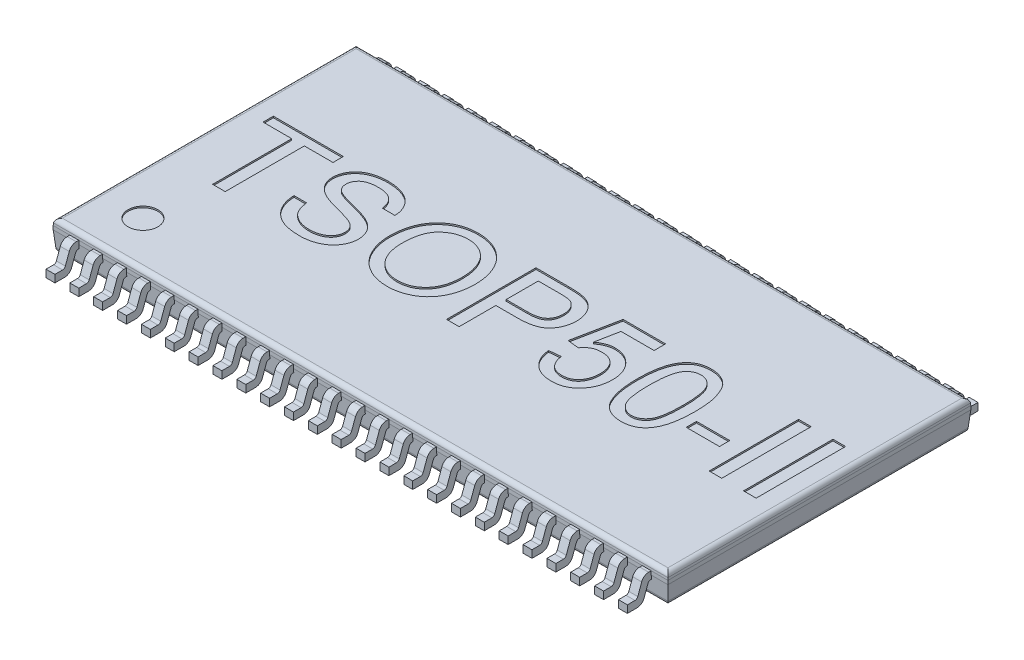
from build123d import *

# Parameters (mm, degrees)
BOSS_EXTRUDE1_START   = 0.715
SKETCH1_W             = 20.62
SKETCH1_H             = 10.16
BOSS_EXTRUDE1_DEPTH   = 0.665
BOSS_EXTRUDE1_DRAFT   = -5
SKETCH2_W             = 20.62
SKETCH2_H             = 10.16
BOSS_EXTRUDE2_DEPTH   = 0.125
SKETCH3_W             = 20.62
SKETCH3_H             = 10.16
BOSS_EXTRUDE3_DEPTH   = 0.21
BOSS_EXTRUDE3_TAPER   = 5
FILLET1_R             = 0.15
BOSS_EXTRUDE4_DEPTH   = 0.15
BOSS_EXTRUDE4_2_DEPTH = 0.15
LPATTERN1_COUNT       = 25
LPATTERN1_PITCH       = 0.8
SKETCH7_R             = 0.5
SKETCH7_W             = 1.115384616
SKETCH7_H             = 0.346153846
SKETCH7_W_2           = 0.423076923
SKETCH7_H_2           = 3
CUT_EXTRUDE1_DEPTH    = 0.05


with BuildPart() as part:
    # Sketch1 → Boss-Extrude1 (with draft: the straight prism first)
    with BuildSketch(Plane(origin=(0, 0, 0), x_dir=(1, 0, 0), z_dir=(0, 1, 0)).offset(BOSS_EXTRUDE1_START)):
        Rectangle(SKETCH1_W, SKETCH1_H)
    extrude(amount=-BOSS_EXTRUDE1_DEPTH)
    # Boss-Extrude1: the draft: its side faces are tilted about the plane it starts from
    boss_extrude1_sides = [part.faces().sort_by_distance(p)[0] for p in [
        (0, 0.3825, 5.08),
        (10.31, 0.3825, 0),
        (0, 0.3825, -5.08),
        (-10.31, 0.3825, 0),
    ]]
    draft(boss_extrude1_sides, Plane(origin=(0, 0, 0), x_dir=(1, 0, 0), z_dir=(0, 1, 0)).offset(BOSS_EXTRUDE1_START), BOSS_EXTRUDE1_DRAFT)

    # Sketch2 → Boss-Extrude2 (add)
    with BuildSketch(Plane(origin=(0, 0.715, 0), x_dir=(1, 0, 0), z_dir=(0, 1, 0))):
        Rectangle(SKETCH2_W, SKETCH2_H)
    extrude(amount=BOSS_EXTRUDE2_DEPTH)

    # Sketch3 → Boss-Extrude3 (add)
    with BuildSketch(Plane(origin=(0, 0.84, 0), x_dir=(1, 0, 0), z_dir=(0, 1, 0))):
        Rectangle(SKETCH3_W, SKETCH3_H)
    extrude(amount=BOSS_EXTRUDE3_DEPTH, taper=BOSS_EXTRUDE3_TAPER)

    # Fillet1
    fillet1_edges = [part.edges().sort_by_distance(p)[0] for p in [
        (-10.251820039, 0.05, 0),
        (0, 0.05, 5.021820039),
        (-10.291627381, 1.05, 0),
        (0, 1.05, 5.061627381),
        (10.291627381, 1.05, 0),
        (0, 1.05, -5.061627381),
        (10.251820039, 0.05, 0),
        (0, 0.05, -5.021820039),
    ]]
    fillet(fillet1_edges, radius=FILLET1_R)

    # Sketch7 → Cut-Extrude1 (cut)
    # profile 1 of 10: a face of its own
    with BuildSketch(Plane(origin=(0, 1.05, 0), x_dir=(1, 0, 0), z_dir=(0, 1, 0))):
        with Locations(Location((-8.803606909, -3.573606909, 0), (0, 0, 270))):
            Circle(SKETCH7_R)
    # profile 2 of 10: a face of its own
    with BuildSketch(Plane(origin=(0, 1.05, 0), x_dir=(1, 0, 0), z_dir=(0, 1, 0))):
        Polygon((-8.620349713, -1.421523076), (-8.620349713, 1.232323077), (-9.581888174, 1.232323077), (-9.581888174, 1.578476924), (-7.235734328, 1.578476924), (-7.235734328, 1.232323077), (-8.19727279, 1.232323077), (-8.19727279, -1.421523076), align=None)
    # profile 3 of 10: a face of its own
    with BuildSketch(Plane(origin=(0, 1.05, 0), x_dir=(1, 0, 0), z_dir=(0, 1, 0))):
        with BuildLine():
            Line((-6.92804202, -0.383061538), (-6.504965097, -0.383061538))
            add(Edge.make_bspline(
                [(-6.504965097, -0.383061538), (-6.500311497, -0.421048028), (-6.491371679, -0.494022121), (-6.466375056, -0.597451912), (-6.43420279, -0.690445909), (-6.394117033, -0.774238306), (-6.341385747, -0.847824438), (-6.277853618, -0.914198005), (-6.200697305, -0.971673495), (-6.113605416, -1.022822916), (-6.016609357, -1.062983301), (-5.913057413, -1.092754855), (-5.803443437, -1.110394739), (-5.728386532, -1.112669327), (-5.690061251, -1.113830769)],
                knots=[0, 0, 0, 0, 1.125557648, 2.162256852, 3.1243583, 4.018160113, 4.88511607, 5.777380551, 6.711250965, 7.707237736, 8.743031335, 9.791730543, 10.872421559, 12, 12, 12, 12], degree=3))
            add(Edge.make_bspline(
                [(-5.690061251, -1.113830769), (-5.656146678, -1.113203046), (-5.590019827, -1.111979108), (-5.494359947, -1.097276586), (-5.404343721, -1.076421453), (-5.321646446, -1.044874798), (-5.246573184, -1.006567269), (-5.181380466, -0.960233413), (-5.125722392, -0.907981552), (-5.082138085, -0.8484354), (-5.047899124, -0.786040991), (-5.022781306, -0.721905973), (-5.007819137, -0.656386326), (-5.005912568, -0.612301329), (-5.004965097, -0.590393269)],
                knots=[0, 0, 0, 0, 1.267006637, 2.470417599, 3.611360613, 4.716023143, 5.771382139, 6.754486395, 7.697536124, 8.612899418, 9.501261124, 10.352596716, 11.181322154, 12, 12, 12, 12], degree=3))
            add(Edge.make_bspline(
                [(-5.004965097, -0.590393269), (-5.005977961, -0.568707125), (-5.007957602, -0.526321587), (-5.020858371, -0.464613539), (-5.045378106, -0.40813275), (-5.077195281, -0.35457394), (-5.121458403, -0.305606011), (-5.177379863, -0.260486433), (-5.24619175, -0.219580586), (-5.297549472, -0.19717816), (-5.324676636, -0.185345192)],
                knots=[0, 0, 0, 0, 0.942140154, 1.841411588, 2.718743672, 3.605002079, 4.535543111, 5.568170452, 6.715506882, 8, 8, 8, 8], degree=3))
            add(Edge.make_bspline(
                [(-5.324676636, -0.185345192), (-5.33524578, -0.181007964), (-5.359123397, -0.171209378), (-5.400048513, -0.158237737), (-5.448611345, -0.141464081), (-5.505978577, -0.124189946), (-5.571843097, -0.105916327), (-5.646095247, -0.085233361), (-5.728693537, -0.063238159), (-5.817295335, -0.039826662), (-5.906756151, -0.016020759), (-5.99222551, 0.007807437), (-6.070861384, 0.031996108), (-6.143307906, 0.055286459), (-6.209191581, 0.078672899), (-6.268699403, 0.101515156), (-6.321905564, 0.123349793), (-6.354401862, 0.139404466), (-6.369748751, 0.146986539)],
                knots=[0, 0, 0, 0, 0.499201778, 1.127787504, 1.87543728, 2.745208432, 3.745951656, 4.863402235, 6.114490242, 7.482339553, 8.869366102, 10.161191451, 11.360587006, 12.46547846, 13.487450326, 14.41601931, 15.251940103, 16, 16, 16, 16], degree=3))
            add(Edge.make_bspline(
                [(-6.369748751, 0.146986539), (-6.405057664, 0.166061431), (-6.473213054, 0.202880936), (-6.564942661, 0.268714314), (-6.642234168, 0.341768633), (-6.704761495, 0.421937959), (-6.753761715, 0.507866437), (-6.786821949, 0.599700147), (-6.80946548, 0.695772135), (-6.811581577, 0.761836689), (-6.812657405, 0.795424039)],
                knots=[0, 0, 0, 0, 1.158441928, 2.236094408, 3.251151369, 4.220012324, 5.163146324, 6.095083285, 7.031536583, 8, 8, 8, 8], degree=3))
            add(Edge.make_bspline(
                [(-6.812657405, 0.795424039), (-6.811229567, 0.832616355), (-6.808389609, 0.906591603), (-6.783197619, 1.015145666), (-6.743015914, 1.11960355), (-6.697276931, 1.202534196), (-6.652671314, 1.26524598), (-6.615692919, 1.31040986), (-6.574214417, 1.352157795), (-6.529513201, 1.391072558), (-6.480790191, 1.426572719), (-6.429254212, 1.460117288), (-6.373039947, 1.48894965), (-6.294050544, 1.525646739), (-6.188381757, 1.562292214), (-6.055357971, 1.594224097), (-5.915354803, 1.613028119), (-5.819925355, 1.615616578), (-5.771191059, 1.616938462)],
                knots=[0, 0, 0, 0, 1.199927478, 2.386647047, 3.578628709, 4.806592355, 5.433127754, 6.062729195, 6.689531802, 7.331674828, 7.974827539, 8.635320743, 9.315455226, 10.01318112, 11.447700238, 12.918145351, 14.426146008, 16, 16, 16, 16], degree=3))
            add(Edge.make_bspline(
                [(-5.771191059, 1.616938462), (-5.717848135, 1.61571619), (-5.613979183, 1.613336192), (-5.46305466, 1.593535039), (-5.322283397, 1.559531248), (-5.211885742, 1.521467416), (-5.130270047, 1.482932951), (-5.072287985, 1.452864899), (-5.018469166, 1.418100754), (-4.968329111, 1.38048051), (-4.921402088, 1.340021348), (-4.878894227, 1.29576088), (-4.838959717, 1.249209191), (-4.792031103, 1.182375551), (-4.741432108, 1.093921607), (-4.69768239, 0.979326009), (-4.667625823, 0.858379764), (-4.661779129, 0.774766528), (-4.658811251, 0.732323077)],
                knots=[0, 0, 0, 0, 1.607600973, 3.130308851, 4.577334065, 5.967726088, 6.640410691, 7.296826776, 7.935019992, 8.569057421, 9.185393759, 9.8003086, 10.417295362, 11.032210203, 12.259799365, 13.477607022, 14.719591916, 16, 16, 16, 16], degree=3))
            Line((-4.658811251, 0.732323077), (-5.081888174, 0.732323077))
            add(Edge.make_bspline(
                [(-5.081888174, 0.732323077), (-5.084576343, 0.753804949), (-5.089836292, 0.795838605), (-5.102885527, 0.856688646), (-5.121177928, 0.913203425), (-5.142603936, 0.965909982), (-5.168576744, 1.014260111), (-5.198853522, 1.058718078), (-5.233802978, 1.098760092), (-5.272525825, 1.135444218), (-5.316200392, 1.167385851), (-5.364602266, 1.195112169), (-5.417813151, 1.218534559), (-5.475786168, 1.23771826), (-5.538532794, 1.252592552), (-5.606195748, 1.263534364), (-5.678748876, 1.269138157), (-5.728715086, 1.270226129), (-5.754364136, 1.270784616)],
                knots=[0, 0, 0, 0, 1.074487479, 2.102453544, 3.083708351, 4.020042547, 4.923259678, 5.803182661, 6.684453325, 7.556870173, 8.445961597, 9.363679789, 10.320905216, 11.327237703, 12.390948353, 13.519046902, 14.726457512, 16, 16, 16, 16], degree=3))
            add(Edge.make_bspline(
                [(-5.754364136, 1.270784616), (-5.781025127, 1.270583658), (-5.832634249, 1.270194653), (-5.907241088, 1.263103575), (-5.976391984, 1.253374364), (-6.039968164, 1.239022951), (-6.097761359, 1.220236903), (-6.150629303, 1.198543328), (-6.197092432, 1.171051903), (-6.23823388, 1.140430032), (-6.273723591, 1.106548622), (-6.304310464, 1.070845808), (-6.33136219, 1.034370564), (-6.352381979, 0.99512913), (-6.369495246, 0.954607637), (-6.380535183, 0.912044415), (-6.388351717, 0.868226772), (-6.389165234, 0.838329116), (-6.389580482, 0.82306827)],
                knots=[0, 0, 0, 0, 1.464176581, 2.834285765, 4.113735764, 5.29917439, 6.409476712, 7.449999357, 8.431575861, 9.367089851, 10.262376129, 11.120706676, 11.948504824, 12.751342953, 13.560717798, 14.359016663, 15.162382702, 16, 16, 16, 16], degree=3))
            add(Edge.make_bspline(
                [(-6.389580482, 0.82306827), (-6.388487152, 0.797257588), (-6.386365098, 0.747161436), (-6.36469583, 0.675989904), (-6.331368345, 0.611112441), (-6.298535461, 0.575812945), (-6.282008367, 0.558044231)],
                knots=[0, 0, 0, 0, 1.050964922, 2.039826012, 3.013306874, 4, 4, 4, 4], degree=3))
            add(Edge.make_bspline(
                [(-6.282008367, 0.558044231), (-6.271589862, 0.549164278), (-6.248549984, 0.529526811), (-6.205680738, 0.503538922), (-6.152529231, 0.477281472), (-6.088740314, 0.451179535), (-6.014423736, 0.424916237), (-5.929699374, 0.397874941), (-5.83424452, 0.371017878), (-5.730968159, 0.345136655), (-5.626634954, 0.319151387), (-5.527483332, 0.293265156), (-5.436445361, 0.268732133), (-5.353665477, 0.244804188), (-5.279058001, 0.22154898), (-5.212882222, 0.198479283), (-5.154602752, 0.177261013), (-5.118899692, 0.162332228), (-5.102320867, 0.155400001)],
                knots=[0, 0, 0, 0, 0.523891492, 1.158553688, 1.913783773, 2.794766643, 3.797521443, 4.933638669, 6.202080764, 7.596537849, 9.013317056, 10.322179469, 11.523240428, 12.626146501, 13.623953177, 14.517289671, 15.311498917, 16, 16, 16, 16], degree=3))
            add(Edge.make_bspline(
                [(-5.102320867, 0.155400001), (-5.080750973, 0.145454895), (-5.038412887, 0.125934318), (-4.97843532, 0.09260587), (-4.922469742, 0.057996072), (-4.870968318, 0.021173109), (-4.824097579, -0.017940473), (-4.781333453, -0.058896519), (-4.74241766, -0.10146485), (-4.70892045, -0.1470079), (-4.678843392, -0.193684614), (-4.652523963, -0.242147359), (-4.631332065, -0.292681135), (-4.612745448, -0.344676804), (-4.599376339, -0.398712709), (-4.588892262, -0.454243052), (-4.582777074, -0.511528841), (-4.582187036, -0.550314949), (-4.581888174, -0.569960576)],
                knots=[0, 0, 0, 0, 1.198900896, 2.353241543, 3.461831299, 4.520043694, 5.547003373, 6.541368882, 7.508191797, 8.454912692, 9.392021408, 10.310662301, 11.235020644, 12.156274873, 13.095836685, 14.042125239, 15.00831306, 16, 16, 16, 16], degree=3))
            add(Edge.make_bspline(
                [(-4.581888174, -0.569960576), (-4.583453817, -0.609167908), (-4.58656214, -0.687007493), (-4.613325914, -0.801746642), (-4.655370387, -0.912928236), (-4.704677947, -1.001156956), (-4.751288495, -1.068550876), (-4.790443553, -1.116990545), (-4.833864262, -1.161780401), (-4.880481647, -1.204323625), (-4.930657649, -1.243752195), (-4.984815282, -1.280079538), (-5.042382938, -1.313683819), (-5.124588103, -1.354632603), (-5.23377022, -1.397468919), (-5.372846317, -1.433141553), (-5.519415679, -1.456283272), (-5.62005925, -1.458733783), (-5.671431444, -1.459984615)],
                knots=[0, 0, 0, 0, 1.197055466, 2.376552968, 3.581957237, 4.820753935, 5.454298064, 6.085440993, 6.72202542, 7.359198513, 8.013298489, 8.67051481, 9.351020706, 10.049282741, 11.476266879, 12.925760103, 14.430794493, 16, 16, 16, 16], degree=3))
            add(Edge.make_bspline(
                [(-5.671431444, -1.459984615), (-5.70409495, -1.459715061), (-5.768078094, -1.459187043), (-5.862094177, -1.452792577), (-5.952191508, -1.443542668), (-6.038281669, -1.429764826), (-6.120094689, -1.411689045), (-6.19792424, -1.389983526), (-6.271954801, -1.364985146), (-6.341927705, -1.335587484), (-6.407660294, -1.301430612), (-6.470334508, -1.26458399), (-6.528925893, -1.222816617), (-6.583557793, -1.176784803), (-6.635614463, -1.127818367), (-6.68293831, -1.07391756), (-6.727138222, -1.016658635), (-6.767204246, -0.955517538), (-6.802997138, -0.891294195), (-6.835185146, -0.825067169), (-6.862303993, -0.756356035), (-6.884159203, -0.685508057), (-6.902671673, -0.612997351), (-6.915509643, -0.53821894), (-6.924948551, -0.461407603), (-6.927004773, -0.409331148), (-6.92804202, -0.383061538)],
                knots=[0, 0, 0, 0, 1.259822038, 2.467811403, 3.633536148, 4.752793854, 5.829021491, 6.863980041, 7.868367876, 8.841470325, 9.788447787, 10.724101269, 11.643985084, 12.560193707, 13.478453146, 14.398077254, 15.323914234, 16.266973849, 17.21495974, 18.158525798, 19.105629373, 20.061269543, 21.017128399, 21.990322895, 22.986232211, 24, 24, 24, 24], degree=3))
        make_face()
    # profile 4 of 10: a face of its own
    with BuildSketch(Plane(origin=(0, 1.05, 0), x_dir=(1, 0, 0), z_dir=(0, 1, 0))):
        with BuildLine():
            add(Edge.make_bspline(
                [(-4.158811251, 0.038813462), (-4.157768567, 0.098960876), (-4.155736949, 0.216155063), (-4.136754447, 0.386804899), (-4.105931737, 0.547364073), (-4.061867945, 0.697820075), (-4.006016962, 0.838408671), (-3.938119423, 0.969448204), (-3.856133016, 1.089455399), (-3.763385496, 1.199572646), (-3.659790777, 1.296924365), (-3.549491845, 1.383386638), (-3.431111413, 1.455506396), (-3.305743226, 1.51505354), (-3.172854647, 1.560772113), (-3.032818789, 1.592779274), (-2.885785417, 1.613427004), (-2.785284666, 1.615750975), (-2.733931444, 1.616938462)],
                knots=[0, 0, 0, 0, 1.203621547, 2.345195544, 3.432004029, 4.472479546, 5.478447225, 6.455936844, 7.420185704, 8.381829745, 9.332027588, 10.260832629, 11.182364398, 12.100723901, 13.034044877, 13.989196293, 14.972532542, 16, 16, 16, 16], degree=3))
            add(Edge.make_bspline(
                [(-2.733931444, 1.616938462), (-2.700060464, 1.616347011), (-2.632798826, 1.615172496), (-2.533358496, 1.606236007), (-2.436473434, 1.590285922), (-2.342239045, 1.568911019), (-2.250398824, 1.540868075), (-2.160897926, 1.507764234), (-2.07451983, 1.466743914), (-1.990689887, 1.420817583), (-1.910397646, 1.369446997), (-1.834939199, 1.312698014), (-1.764495294, 1.250999825), (-1.698119676, 1.18536658), (-1.638027207, 1.113583248), (-1.581735314, 1.037836474), (-1.530861578, 0.956783143), (-1.485225488, 0.87108735), (-1.444422186, 0.782072652), (-1.409547885, 0.689370119), (-1.379601959, 0.594091782), (-1.354534693, 0.495673695), (-1.336548253, 0.394149506), (-1.322225456, 0.28995667), (-1.314686972, 0.182754651), (-1.313339634, 0.110337778), (-1.312657405, 0.073669231)],
                knots=[0, 0, 0, 0, 1.034375294, 2.054082248, 3.045783978, 4.031219655, 5.002789406, 5.976610191, 6.94273282, 7.920236376, 8.894345378, 9.851183672, 10.800797181, 11.752517031, 12.698794154, 13.65688337, 14.632873302, 15.61821402, 16.620222298, 17.621258913, 18.640965868, 19.669244166, 20.720417492, 21.788124603, 22.880008887, 24, 24, 24, 24], degree=3))
            add(Edge.make_bspline(
                [(-1.312657405, 0.073669231), (-1.313282476, 0.03639602), (-1.314517411, -0.037243636), (-1.322873486, -0.146031939), (-1.337566371, -0.251697155), (-1.357053982, -0.354554359), (-1.383166785, -0.454389424), (-1.414197839, -0.551488583), (-1.451731652, -0.645273493), (-1.494121926, -0.735970197), (-1.542086503, -0.8223313), (-1.594994687, -0.903752923), (-1.652883958, -0.979473433), (-1.714874987, -1.050421726), (-1.782415426, -1.115329114), (-1.85467361, -1.174802529), (-1.931371704, -1.229402873), (-2.012767376, -1.277651398), (-2.097399869, -1.319942954), (-2.183594439, -1.357463183), (-2.271415115, -1.389461928), (-2.36116204, -1.41539373), (-2.452590393, -1.434989666), (-2.545442884, -1.449663309), (-2.640023896, -1.458112444), (-2.70366691, -1.459357351), (-2.735734328, -1.459984615)],
                knots=[0, 0, 0, 0, 1.141429366, 2.255090526, 3.338676798, 4.407031443, 5.458968682, 6.496860253, 7.526652771, 8.550250826, 9.560787671, 10.54935636, 11.521089193, 12.477323897, 13.431786008, 14.386110112, 15.340986122, 16.312041, 17.28047646, 18.236612773, 19.189437236, 20.140779471, 21.09494583, 22.051062463, 23.018000708, 24, 24, 24, 24], degree=3))
            add(Edge.make_bspline(
                [(-2.735734328, -1.459984615), (-2.770213925, -1.459474485), (-2.838509371, -1.458464045), (-2.93945188, -1.448378136), (-3.037883097, -1.43299173), (-3.133516867, -1.410778407), (-3.226222509, -1.381799559), (-3.316109715, -1.346724478), (-3.403494628, -1.306021932), (-3.487292946, -1.258526474), (-3.567219453, -1.205716629), (-3.642499474, -1.147854914), (-3.71309138, -1.085474576), (-3.777862461, -1.017544541), (-3.838910449, -0.946527301), (-3.89379437, -0.869783188), (-3.944306647, -0.789052678), (-3.98895254, -0.703557564), (-4.029283423, -0.615838437), (-4.063263063, -0.525867238), (-4.093124581, -0.434969904), (-4.116906258, -0.34258618), (-4.13585736, -0.248929175), (-4.148600603, -0.154154732), (-4.15780387, -0.0581217), (-4.158473767, 0.006339138), (-4.158811251, 0.038813462)],
                knots=[0, 0, 0, 0, 1.072727997, 2.12480551, 3.153819198, 4.171534612, 5.177148798, 6.173931848, 7.17235114, 8.174500385, 9.168706755, 10.151274001, 11.127173509, 12.097141049, 13.070188938, 14.039134204, 15.03036519, 16.031505612, 17.038625933, 18.033164522, 19.022845559, 20.014762458, 21.000193215, 21.994692725, 22.989758729, 24, 24, 24, 24], degree=3))
        make_face()
        with BuildLine():
            add(Edge.make_bspline(
                [(-3.735734328, 0.03400577), (-3.735085983, -0.009305795), (-3.733821755, -0.093760291), (-3.719358307, -0.216890454), (-3.697412333, -0.333070033), (-3.667162126, -0.442625173), (-3.626498439, -0.544472389), (-3.577879737, -0.639590334), (-3.519669015, -0.727346717), (-3.453150577, -0.807496051), (-3.37998792, -0.879496206), (-3.301806197, -0.942384512), (-3.218587832, -0.99504902), (-3.131255449, -1.038534814), (-3.03918178, -1.072479441), (-2.942642586, -1.096314503), (-2.841566937, -1.111221399), (-2.772645809, -1.112950143), (-2.737537213, -1.113830769)],
                knots=[0, 0, 0, 0, 1.215430442, 2.370003584, 3.475209778, 4.53279855, 5.55522989, 6.548792651, 7.526809858, 8.505409025, 9.467826767, 10.404123909, 11.316848639, 12.227335424, 13.138360512, 14.065900994, 15.014765094, 16, 16, 16, 16], degree=3))
            add(Edge.make_bspline(
                [(-2.737537213, -1.113830769), (-2.701833524, -1.112937117), (-2.631925803, -1.111187351), (-2.529326301, -1.096540682), (-2.431845289, -1.071605352), (-2.338516556, -1.038410779), (-2.251027395, -0.993537375), (-2.167331684, -0.940990865), (-2.089710979, -0.876780534), (-2.016259913, -0.804653039), (-1.950379254, -0.722666893), (-1.891924038, -0.632841677), (-1.844439135, -0.533830241), (-1.80344233, -0.427813672), (-1.773422107, -0.312788214), (-1.751235323, -0.190061478), (-1.737865097, -0.05923869), (-1.736457143, 0.030568727), (-1.735734328, 0.076674039)],
                knots=[0, 0, 0, 0, 0.976878588, 1.912725521, 2.8289017, 3.727303729, 4.617335839, 5.514666588, 6.426584173, 7.368641557, 8.327632997, 9.299405846, 10.294892156, 11.327373912, 12.405931897, 13.542618837, 14.738430195, 16, 16, 16, 16], degree=3))
            add(Edge.make_bspline(
                [(-1.735734328, 0.076674039), (-1.735989771, 0.106335196), (-1.736490856, 0.164519652), (-1.743126912, 0.250284205), (-1.751686572, 0.33338099), (-1.764718788, 0.413702782), (-1.782678835, 0.490916949), (-1.802575517, 0.565611326), (-1.827455621, 0.637142236), (-1.855685568, 0.705790197), (-1.8872744, 0.771202784), (-1.922902401, 0.832828541), (-1.962155501, 0.890427882), (-2.003974606, 0.945092832), (-2.05067542, 0.994707634), (-2.100009272, 1.041368039), (-2.153096779, 1.084110034), (-2.209408147, 1.122944783), (-2.268144527, 1.157902177), (-2.329184832, 1.187821171), (-2.391556605, 1.214101249), (-2.456303861, 1.234246031), (-2.522532565, 1.250493094), (-2.590510449, 1.262834251), (-2.660489828, 1.269225076), (-2.707678297, 1.270261036), (-2.731527597, 1.270784616)],
                knots=[0, 0, 0, 0, 1.220438779, 2.394059227, 3.538503547, 4.658058814, 5.74010225, 6.800155734, 7.837851593, 8.854470756, 9.853724944, 10.825214244, 11.781044712, 12.72106398, 13.654479919, 14.581868691, 15.514082315, 16.456304431, 17.39516604, 18.324312202, 19.252140633, 20.177768678, 21.111585046, 22.057694709, 23.018348693, 24, 24, 24, 24], degree=3))
            add(Edge.make_bspline(
                [(-2.731527597, 1.270784616), (-2.76523533, 1.270115194), (-2.831744442, 1.268794349), (-2.929653773, 1.254111109), (-3.024048984, 1.232172342), (-3.115076566, 1.201500777), (-3.201957974, 1.160886805), (-3.285143333, 1.111079327), (-3.365371036, 1.053434521), (-3.441376005, 0.986547884), (-3.512229262, 0.909711467), (-3.572128582, 0.819123686), (-3.622613365, 0.716947061), (-3.664767229, 0.603440586), (-3.696908309, 0.477725229), (-3.719121816, 0.340342002), (-3.73314697, 0.191146137), (-3.734849827, 0.087724992), (-3.735734328, 0.03400577)],
                knots=[0, 0, 0, 0, 0.895090134, 1.766112571, 2.624765742, 3.468151641, 4.313618154, 5.168136083, 6.041303099, 6.935189387, 7.854749729, 8.809996334, 9.809869957, 10.877771942, 12.021723904, 13.25217762, 14.572720513, 16, 16, 16, 16], degree=3))
        make_face(mode=Mode.SUBTRACT)
    # profile 5 of 10: a face of its own
    with BuildSketch(Plane(origin=(0, 1.05, 0), x_dir=(1, 0, 0), z_dir=(0, 1, 0))):
        with BuildLine():
            Line((-0.774195867, -1.421523076), (-0.774195867, 1.578476924))
            Line((-0.774195867, 1.578476924), (0.327967595, 1.578476924))
            add(Edge.make_bspline(
                [(0.327967595, 1.578476924), (0.373651382, 1.578216659), (0.459445749, 1.577727882), (0.579256479, 1.572003669), (0.682139899, 1.564921869), (0.744281898, 1.554839229), (0.772679133, 1.550231731)],
                knots=[0, 0, 0, 0, 1.22865052, 2.30741144, 3.226532197, 4, 4, 4, 4], degree=3))
            add(Edge.make_bspline(
                [(0.772679133, 1.550231731), (0.807316905, 1.543565615), (0.874454562, 1.530644823), (0.969511078, 1.499495595), (1.056113071, 1.46073276), (1.134125197, 1.412438267), (1.204843481, 1.355704051), (1.267260105, 1.287723142), (1.322587732, 1.210013434), (1.369633115, 1.12263573), (1.408791188, 1.028617358), (1.436217655, 0.928455261), (1.453784357, 0.823889617), (1.455633369, 0.752427044), (1.456573364, 0.716097116)],
                knots=[0, 0, 0, 0, 1.070909925, 2.075721949, 3.031861647, 3.947440733, 4.85625699, 5.777986723, 6.742441087, 7.747548058, 8.78749499, 9.830146138, 10.896896232, 12, 12, 12, 12], degree=3))
            add(Edge.make_bspline(
                [(1.456573364, 0.716097116), (1.455910911, 0.685013243), (1.454607497, 0.623854021), (1.443415292, 0.534002298), (1.425762765, 0.447561286), (1.399431628, 0.365122517), (1.367241104, 0.285722198), (1.326673607, 0.210699436), (1.279302215, 0.139035485), (1.224952529, 0.070925348), (1.160967852, 0.007751136), (1.083986421, -0.045839763), (0.995492444, -0.090841054), (0.895465282, -0.12720161), (0.784147752, -0.155811508), (0.66117512, -0.176773574), (0.526307831, -0.188346378), (0.432556586, -0.189930806), (0.383857018, -0.190753846)],
                knots=[0, 0, 0, 0, 0.928769099, 1.82740408, 2.702266355, 3.562020322, 4.410419678, 5.259600434, 6.10654066, 6.975254961, 7.860221694, 8.783881459, 9.766664779, 10.81996744, 11.958551584, 13.197863772, 14.544415867, 16, 16, 16, 16], degree=3))
            Line((0.383857018, -0.190753846), (-0.351118944, -0.190753846))
            Line((-0.351118944, -0.190753846), (-0.351118944, -1.421523076))
            Line((-0.351118944, -1.421523076), (-0.774195867, -1.421523076))
        make_face()
        with BuildLine():
            Line((-0.351118944, 0.155400001), (0.372438749, 0.155400001))
            add(Edge.make_bspline(
                [(0.372438749, 0.155400001), (0.401297073, 0.155882523), (0.45688996, 0.156812057), (0.537219146, 0.163298851), (0.610941517, 0.174527194), (0.678261572, 0.190187444), (0.739265032, 0.209652685), (0.793842749, 0.234270858), (0.841713283, 0.263801755), (0.883193835, 0.297944454), (0.918800208, 0.336192606), (0.949652284, 0.377919229), (0.975865876, 0.423422508), (0.996414234, 0.472892822), (1.013821526, 0.525367879), (1.024686819, 0.581934966), (1.032241423, 0.641773776), (1.033072236, 0.683018658), (1.033496441, 0.704077885)],
                knots=[0, 0, 0, 0, 1.403696362, 2.704090955, 3.91683431, 5.027708188, 6.063065288, 7.026749679, 7.932587242, 8.790956304, 9.632005367, 10.468072405, 11.310475089, 12.179234342, 13.069796908, 13.994719932, 14.976123913, 16, 16, 16, 16], degree=3))
            add(Edge.make_bspline(
                [(1.033496441, 0.704077885), (1.03260025, 0.734617123), (1.030863744, 0.793791505), (1.013368018, 0.878941617), (0.985938416, 0.957621831), (0.946667297, 1.028342482), (0.89913782, 1.090383328), (0.843267928, 1.141142953), (0.780848824, 1.181723402), (0.734243752, 1.197791281), (0.710780095, 1.20588077)],
                knots=[0, 0, 0, 0, 1.143156811, 2.215038775, 3.243253804, 4.254666983, 5.233799895, 6.158487526, 7.072877374, 8, 8, 8, 8], degree=3))
            add(Edge.make_bspline(
                [(0.710780095, 1.20588077), (0.702186952, 1.207981983), (0.683513461, 1.212548064), (0.65258097, 1.217730635), (0.616731843, 1.222638069), (0.575791333, 1.225893923), (0.530132807, 1.229127401), (0.479616681, 1.230617954), (0.424127882, 1.231905366), (0.385460609, 1.232179586), (0.36522721, 1.232323077)],
                knots=[0, 0, 0, 0, 0.611063981, 1.327884044, 2.165719042, 3.110592661, 4.16481496, 5.328235826, 6.601947678, 8, 8, 8, 8], degree=3))
            Line((0.36522721, 1.232323077), (-0.351118944, 1.232323077))
            Line((-0.351118944, 1.232323077), (-0.351118944, 0.155400001))
        make_face(mode=Mode.SUBTRACT)
    # profile 6 of 10: a face of its own
    with BuildSketch(Plane(origin=(0, 1.05, 0), x_dir=(1, 0, 0), z_dir=(0, 1, 0))):
        with BuildLine():
            Line((1.841188749, -0.613830769), (2.225804133, -0.57536923))
            add(Edge.make_bspline(
                [(2.225804133, -0.57536923), (2.22961243, -0.597040196), (2.237020158, -0.639193596), (2.251136403, -0.700211892), (2.269469387, -0.756899594), (2.290068512, -0.809747651), (2.314554048, -0.85819726), (2.34108433, -0.903013416), (2.372371374, -0.942605284), (2.405265501, -0.979043556), (2.441369318, -1.011152119), (2.481031201, -1.038220745), (2.523144557, -1.061836482), (2.568222311, -1.081171998), (2.61633355, -1.095324577), (2.666865946, -1.106516838), (2.720470196, -1.112156566), (2.757044009, -1.113265565), (2.775683941, -1.113830769)],
                knots=[0, 0, 0, 0, 1.237781394, 2.407677316, 3.51963579, 4.58689595, 5.594855907, 6.570874, 7.510833816, 8.428091223, 9.330271693, 10.221190844, 11.124215526, 12.043132878, 12.973586933, 13.941700858, 14.950982896, 16, 16, 16, 16], degree=3))
            add(Edge.make_bspline(
                [(2.775683941, -1.113830769), (2.798550962, -1.113278235), (2.843268417, -1.112197732), (2.908323844, -1.103059267), (2.969773963, -1.087990997), (3.027324746, -1.066904073), (3.081650862, -1.040679988), (3.130950078, -1.006724575), (3.177910457, -0.968555335), (3.219510088, -0.923050276), (3.257377441, -0.873510418), (3.290059813, -0.819435556), (3.317573752, -0.761584673), (3.340737482, -0.699968861), (3.357842207, -0.634236128), (3.370424113, -0.564736162), (3.378501194, -0.49142469), (3.379261825, -0.441176025), (3.379650287, -0.415513461)],
                knots=[0, 0, 0, 0, 1.052816602, 2.058828735, 3.018813999, 3.961574988, 4.877590722, 5.788574389, 6.712363302, 7.658909047, 8.620312049, 9.580784896, 10.562948504, 11.56722449, 12.607883026, 13.686460295, 14.818448981, 16, 16, 16, 16], degree=3))
            add(Edge.make_bspline(
                [(3.379650287, -0.415513461), (3.379208767, -0.391057372), (3.378349025, -0.343435694), (3.371108592, -0.274090612), (3.358893129, -0.20888525), (3.343087463, -0.14710093), (3.321301347, -0.089703109), (3.295461787, -0.035859573), (3.263807239, 0.013286958), (3.228589466, 0.05926673), (3.188366323, 0.100485743), (3.142594402, 0.135289978), (3.093069309, 0.165750713), (3.038793557, 0.190452469), (2.979735187, 0.208804945), (2.916481075, 0.222925524), (2.848374866, 0.230352371), (2.801540675, 0.231654374), (2.777486826, 0.232323077)],
                knots=[0, 0, 0, 0, 1.165854935, 2.270189951, 3.319242023, 4.32700288, 5.306253956, 6.24172124, 7.169108591, 8.088047231, 8.999810445, 9.905349262, 10.822648491, 11.767237767, 12.739852311, 13.766490849, 14.852878837, 16, 16, 16, 16], degree=3))
            add(Edge.make_bspline(
                [(2.777486826, 0.232323077), (2.747577032, 0.231448158), (2.690216815, 0.229770259), (2.607796083, 0.215654701), (2.532765506, 0.192852815), (2.465974578, 0.158869378), (2.406300185, 0.118270581), (2.352502622, 0.072331201), (2.304138275, 0.021082295), (2.277608461, -0.017502182), (2.264265672, -0.036907692)],
                knots=[0, 0, 0, 0, 1.182877094, 2.268490576, 3.298955169, 4.273890847, 5.221533034, 6.149304476, 7.069219215, 8, 8, 8, 8], degree=3))
            Line((2.264265672, -0.036907692), (1.879650287, 0.001553847))
            Line((1.879650287, 0.001553847), (2.187342595, 1.540015385))
            Line((2.187342595, 1.540015385), (3.610419518, 1.540015385))
            Line((3.610419518, 1.540015385), (3.610419518, 1.155400001))
            Line((3.610419518, 1.155400001), (2.50164548, 1.155400001))
            Line((2.50164548, 1.155400001), (2.349001249, 0.378356731))
            add(Edge.make_bspline(
                [(2.349001249, 0.378356731), (2.370223296, 0.394282053), (2.411900039, 0.425556865), (2.476908288, 0.466507109), (2.542846086, 0.501025434), (2.609329594, 0.52929304), (2.676886918, 0.551313455), (2.745110386, 0.566612223), (2.814232287, 0.57695203), (2.860582599, 0.577967176), (2.883857018, 0.578476924)],
                knots=[0, 0, 0, 0, 1.093835215, 2.148119334, 3.164235237, 4.159999629, 5.123971815, 6.089888814, 7.040853737, 8, 8, 8, 8], degree=3))
            add(Edge.make_bspline(
                [(2.883857018, 0.578476924), (2.914147097, 0.5776833), (2.973795608, 0.576120461), (3.061689755, 0.563279777), (3.145731344, 0.541481863), (3.226579592, 0.512123252), (3.303168419, 0.473203398), (3.376273616, 0.426079718), (3.445600031, 0.370363786), (3.510755742, 0.307106847), (3.569854564, 0.236884994), (3.622749938, 0.161988417), (3.66595199, 0.080917893), (3.702287881, -0.004209813), (3.729693188, -0.094792104), (3.750494772, -0.18954343), (3.761616689, -0.289648401), (3.763368858, -0.357796584), (3.764265672, -0.392676923)],
                knots=[0, 0, 0, 0, 0.991958705, 1.953407265, 2.902004973, 3.832128134, 4.765371166, 5.71007953, 6.676509202, 7.674246545, 8.68000108, 9.679398714, 10.671856529, 11.683459888, 12.706765812, 13.76733029, 14.85725088, 16, 16, 16, 16], degree=3))
            add(Edge.make_bspline(
                [(3.764265672, -0.392676923), (3.763584673, -0.4259585), (3.762239507, -0.491699112), (3.75121559, -0.588580057), (3.733056307, -0.681932473), (3.708746038, -0.772032805), (3.675899602, -0.858369354), (3.636059949, -0.941220992), (3.590102676, -1.02145225), (3.553247327, -1.07091019), (3.534698364, -1.095801923)],
                knots=[0, 0, 0, 0, 1.059692978, 2.093196008, 3.100373587, 4.086253034, 5.061402885, 6.037282833, 7.012182238, 8, 8, 8, 8], degree=3))
            add(Edge.make_bspline(
                [(3.534698364, -1.095801923), (3.511132427, -1.124858409), (3.464775698, -1.182015636), (3.384509528, -1.256202297), (3.298222257, -1.319250748), (3.20540038, -1.370473046), (3.106667038, -1.411634499), (3.000809322, -1.439025901), (2.889106338, -1.457420312), (2.812420073, -1.459118086), (2.773280095, -1.459984615)],
                knots=[0, 0, 0, 0, 1.023140956, 2.012628108, 2.982342558, 3.942221589, 4.908720554, 5.902469194, 6.929439212, 8, 8, 8, 8], degree=3))
            add(Edge.make_bspline(
                [(2.773280095, -1.459984615), (2.740995823, -1.459329734), (2.677841307, -1.458048655), (2.585371859, -1.44691156), (2.497422479, -1.429151821), (2.413965615, -1.403678858), (2.334749833, -1.371491385), (2.260695912, -1.330602258), (2.190518729, -1.283827642), (2.125761946, -1.229726422), (2.066760085, -1.169382763), (2.013893219, -1.104075217), (1.967876782, -1.033761198), (1.928732982, -0.958861449), (1.896108432, -0.879447803), (1.871149362, -0.79497823), (1.851379701, -0.706281508), (1.844621351, -0.644970805), (1.841188749, -0.613830769)],
                knots=[0, 0, 0, 0, 1.108768375, 2.168973506, 3.19473529, 4.187459816, 5.162590879, 6.12651078, 7.088512529, 8.056012598, 9.019588496, 9.983680353, 10.938070192, 11.90157236, 12.88306954, 13.882379887, 14.924449348, 16, 16, 16, 16], degree=3))
        make_face()
    # profile 7 of 10: a face of its own
    with BuildSketch(Plane(origin=(0, 1.05, 0), x_dir=(1, 0, 0), z_dir=(0, 1, 0))):
        with BuildLine():
            add(Edge.make_bspline(
                [(4.148881056, 0.058044231), (4.149268557, 0.100916985), (4.150027506, 0.184886655), (4.154735023, 0.307749368), (4.162953967, 0.424426998), (4.175222586, 0.534818218), (4.189750931, 0.639172202), (4.20863787, 0.737340026), (4.229888423, 0.829541945), (4.255385273, 0.915681853), (4.283397964, 0.996500398), (4.315179255, 1.071867928), (4.350937519, 1.141704535), (4.38891546, 1.206734465), (4.431112313, 1.265946234), (4.474981162, 1.321001567), (4.523710133, 1.36988137), (4.575272969, 1.413843325), (4.630428948, 1.452637189), (4.68888624, 1.486111614), (4.750419917, 1.515667117), (4.816202742, 1.537916493), (4.884869077, 1.55605445), (4.95694748, 1.569396952), (5.03251738, 1.577262807), (5.084158784, 1.578067646), (5.110419518, 1.578476924)],
                knots=[0, 0, 0, 0, 1.514747001, 2.966751498, 4.343369068, 5.64627492, 6.890416844, 8.064737671, 9.177176366, 10.232018008, 11.237056675, 12.19799043, 13.119080079, 14.007588942, 14.855863561, 15.685992447, 16.491747269, 17.290132607, 18.077525251, 18.870243746, 19.668095604, 20.485086593, 21.319398728, 22.175900658, 23.072407314, 24, 24, 24, 24], degree=3))
            add(Edge.make_bspline(
                [(5.110419518, 1.578476924), (5.148947431, 1.57734423), (5.224637062, 1.575119009), (5.335144314, 1.556970505), (5.439290276, 1.525924693), (5.537007286, 1.484042553), (5.626624887, 1.430844175), (5.706657182, 1.366173441), (5.776240893, 1.290709381), (5.834616622, 1.203557771), (5.885642836, 1.107122834), (5.930973405, 1.000971736), (5.971950922, 0.885223429), (6.00102946, 0.781612536), (6.021771158, 0.692171937), (6.035500513, 0.61840386), (6.046898631, 0.538807691), (6.05563113, 0.453575993), (6.062795939, 0.362804361), (6.068328992, 0.266436279), (6.071137583, 0.164230891), (6.071679388, 0.094103338), (6.07195798, 0.058044231)],
                knots=[0, 0, 0, 0, 1.134486744, 2.228744715, 3.287356444, 4.328707449, 5.352829806, 6.347195599, 7.349461267, 8.364207941, 9.428085653, 10.559314403, 11.761222316, 13.04268526, 13.726896727, 14.465273606, 15.252205015, 16.094778733, 16.988606776, 17.934225168, 18.937792761, 20, 20, 20, 20], degree=3))
            add(Edge.make_bspline(
                [(6.07195798, 0.058044231), (6.071563221, 0.015372857), (6.070791982, -0.067994072), (6.066210605, -0.189871632), (6.057496413, -0.305668987), (6.04677344, -0.415651394), (6.030551828, -0.519525252), (6.013072162, -0.617731894), (5.991454134, -0.709825374), (5.966230969, -0.795846056), (5.937823959, -0.876248785), (5.906671276, -0.951641201), (5.872166688, -1.021971788), (5.833283209, -1.086554575), (5.791799934, -1.146246791), (5.747413042, -1.201272355), (5.699181479, -1.25083929), (5.64715398, -1.294669383), (5.592385266, -1.3341512), (5.533785853, -1.367956119), (5.471612224, -1.395962907), (5.406279785, -1.419907319), (5.337125642, -1.43745238), (5.26469514, -1.45088285), (5.188721406, -1.458791683), (5.136880258, -1.459581485), (5.110419518, -1.459984615)],
                knots=[0, 0, 0, 0, 1.508974709, 2.94807912, 4.311757619, 5.615040294, 6.854280449, 8.028314546, 9.141715822, 10.197470207, 11.196696834, 12.155719058, 13.080757287, 13.963948316, 14.818758719, 15.649605906, 16.461113142, 17.260189315, 18.052359509, 18.845763934, 19.647754795, 20.461145776, 21.303032214, 22.167241874, 23.064524267, 24, 24, 24, 24], degree=3))
            add(Edge.make_bspline(
                [(5.110419518, -1.459984615), (5.07572642, -1.458994992), (5.008084427, -1.457065501), (4.909298285, -1.443955795), (4.816582221, -1.420882098), (4.729154228, -1.389937016), (4.647997022, -1.348546187), (4.572723109, -1.298186161), (4.501819913, -1.240028617), (4.461003723, -1.19414365), (4.440347403, -1.170922115)],
                knots=[0, 0, 0, 0, 1.10322584, 2.150986741, 3.161425019, 4.136713905, 5.093944212, 6.049774532, 7.013026876, 8, 8, 8, 8], degree=3))
            add(Edge.make_bspline(
                [(4.440347403, -1.170922115), (4.416571503, -1.13662503), (4.367544579, -1.065902973), (4.310162815, -0.945315306), (4.258977267, -0.812565216), (4.218805995, -0.665048161), (4.187341876, -0.50393821), (4.164616926, -0.328919232), (4.151756842, -0.14006684), (4.149861291, -0.009483539), (4.148881056, 0.058044231)],
                knots=[0, 0, 0, 0, 0.779365345, 1.607084704, 2.489375761, 3.438383567, 4.461919411, 5.557722155, 6.737039282, 8, 8, 8, 8], degree=3))
        make_face()
        with BuildLine():
            add(Edge.make_bspline(
                [(4.533496441, 0.059246154), (4.533878334, 0.001545243), (4.53460936, -0.108907065), (4.542246815, -0.266707243), (4.555394379, -0.409064544), (4.572776316, -0.535781863), (4.595727512, -0.647030613), (4.624545453, -0.742527296), (4.657030126, -0.823418089), (4.697229294, -0.888700414), (4.741242943, -0.941915031), (4.786684027, -0.987681324), (4.834621619, -1.026581624), (4.884742931, -1.059016541), (4.937825631, -1.08357413), (4.993289269, -1.101373525), (5.051145914, -1.111616803), (5.090548918, -1.113088569), (5.110419518, -1.113830769)],
                knots=[0, 0, 0, 0, 1.89448813, 3.626469325, 5.185477471, 6.587276848, 7.82441448, 8.910550357, 9.859733512, 10.6775885, 11.416198291, 12.123144072, 12.791880183, 13.439617036, 14.078171869, 14.70637855, 15.347637704, 16, 16, 16, 16], degree=3))
            add(Edge.make_bspline(
                [(5.110419518, -1.113830769), (5.130285142, -1.113072352), (5.169678279, -1.111568428), (5.227668607, -1.101551023), (5.282916449, -1.082835328), (5.335920003, -1.058364477), (5.386405612, -1.026668849), (5.434107768, -0.987621613), (5.479788226, -0.941882495), (5.523604167, -0.888049355), (5.563497073, -0.822465208), (5.596591119, -0.741640309), (5.624959948, -0.645976382), (5.648037082, -0.534784314), (5.665490723, -0.408267343), (5.678558795, -0.266304878), (5.686247361, -0.108707737), (5.686966323, 0.001544982), (5.687342595, 0.059246154)],
                knots=[0, 0, 0, 0, 0.652509534, 1.29391342, 1.924290653, 2.562989607, 3.207355802, 3.876242846, 4.583348185, 5.32723334, 6.150888545, 7.094226006, 8.186903555, 9.424320409, 10.81992305, 12.379283064, 14.105084285, 16, 16, 16, 16], degree=3))
            add(Edge.make_bspline(
                [(5.687342595, 0.059246154), (5.686978371, 0.115746752), (5.686280531, 0.223999758), (5.678393667, 0.378759912), (5.66603424, 0.518727803), (5.649128509, 0.644032469), (5.626660795, 0.754537875), (5.599410523, 0.850479271), (5.566937749, 0.931652047), (5.528327736, 0.998871585), (5.485347067, 1.054009843), (5.440449684, 1.101736802), (5.392513147, 1.142327026), (5.340688166, 1.174889102), (5.286645157, 1.201158974), (5.229142348, 1.219238569), (5.168744948, 1.230346107), (5.127294996, 1.231656558), (5.106212787, 1.232323077)],
                knots=[0, 0, 0, 0, 1.850066095, 3.544656626, 5.0727657, 6.45041401, 7.682899467, 8.762389858, 9.712573485, 10.538438529, 11.291566246, 11.996865408, 12.681389046, 13.341983376, 13.996294293, 14.643563182, 15.31009126, 16, 16, 16, 16], degree=3))
            add(Edge.make_bspline(
                [(5.106212787, 1.232323077), (5.086343435, 1.231801585), (5.04716362, 1.23077327), (4.989799238, 1.220958009), (4.935435688, 1.204544704), (4.883450138, 1.18231129), (4.83514038, 1.152389506), (4.788590569, 1.117453693), (4.745980919, 1.074888304), (4.720304717, 1.043067085), (4.707174326, 1.026794231)],
                knots=[0, 0, 0, 0, 1.021318143, 2.013908504, 2.982026795, 3.937174072, 4.91255697, 5.897578595, 6.924855925, 8, 8, 8, 8], degree=3))
            add(Edge.make_bspline(
                [(4.707174326, 1.026794231), (4.692879335, 1.00289445), (4.662691325, 0.952423143), (4.628912697, 0.864701933), (4.599073992, 0.764453287), (4.574506845, 0.650134807), (4.556734238, 0.521942596), (4.542703452, 0.380025523), (4.535414981, 0.224185457), (4.534153599, 0.115742831), (4.533496441, 0.059246154)],
                knots=[0, 0, 0, 0, 0.671104906, 1.417232262, 2.260109084, 3.195198885, 4.23592645, 5.382417421, 6.636286093, 8, 8, 8, 8], degree=3))
        make_face(mode=Mode.SUBTRACT)
    # profile 8 of 10: a face of its own
    with BuildSketch(Plane(origin=(0, 1.05, 0), x_dir=(1, 0, 0), z_dir=(0, 1, 0))):
        with Locations((6.937342595, -0.363830769)):
            Rectangle(SKETCH7_W, SKETCH7_H)
    # profile 9 of 10: a face of its own
    with BuildSketch(Plane(origin=(0, 1.05, 0), x_dir=(1, 0, 0), z_dir=(0, 1, 0))):
        with Locations((8.245034903, 0.078476924)):
            Rectangle(SKETCH7_W_2, SKETCH7_H_2)
    # profile 10 of 10: a face of its own
    with BuildSketch(Plane(origin=(0, 1.05, 0), x_dir=(1, 0, 0), z_dir=(0, 1, 0))):
        with Locations((9.398881057, 0.078476924)):
            Rectangle(SKETCH7_W_2, SKETCH7_H_2)
    extrude(amount=-CUT_EXTRUDE1_DEPTH, mode=Mode.SUBTRACT)


with BuildPart() as body_2:
    # Sketch5 → Boss-Extrude4 (new, symmetric)
    with BuildSketch(Plane(origin=(-9.6, 0, 0), x_dir=(0, 0, -1), z_dir=(1, 0, 0))):
        with BuildLine():
            Line((5.095236808, 0.59), (5, 0.59))
            Line((5, 0.59), (5, 0.84))
            Line((5, 0.84), (5.165257562, 0.84))
            ThreePointArc((5.165257562, 0.84), (5.308651671, 0.794788011), (5.400180717, 0.675505036))
            Line((5.400180717, 0.675505036), (5.531103376, 0.315797986))
            ThreePointArc((5.531103376, 0.315797986), (5.567714995, 0.268084796), (5.625072638, 0.25))
            Line((5.625072638, 0.25), (5.88, 0.25))
            Line((5.88, 0.25), (5.88, 0))
            Line((5.88, 0), (5.555051885, 0))
            ThreePointArc((5.555051885, 0), (5.411657775, 0.045211989), (5.320128729, 0.164494964))
            Line((5.320128729, 0.164494964), (5.18920607, 0.524202014))
            ThreePointArc((5.18920607, 0.524202014), (5.152594452, 0.571915204), (5.095236808, 0.59))
        make_face()
    boss_extrude4 = extrude(amount=BOSS_EXTRUDE4_DEPTH, both=True)


with BuildPart() as body_3:
    # Sketch5 → Boss-Extrude4 2 (new, symmetric)
    with BuildSketch(Plane(origin=(-9.6, 0, 0), x_dir=(0, 0, -1), z_dir=(1, 0, 0))):
        with BuildLine():
            Line((-5.320128729, 0.164494964), (-5.18920607, 0.524202014))
            ThreePointArc((-5.18920607, 0.524202014), (-5.152594452, 0.571915204), (-5.095236808, 0.59))
            Line((-5.095236808, 0.59), (-5, 0.59))
            Line((-5, 0.59), (-5, 0.84))
            Line((-5, 0.84), (-5.165257562, 0.84))
            ThreePointArc((-5.165257562, 0.84), (-5.308651671, 0.794788011), (-5.400180717, 0.675505036))
            Line((-5.400180717, 0.675505036), (-5.531103376, 0.315797986))
            ThreePointArc((-5.531103376, 0.315797986), (-5.567714995, 0.268084796), (-5.625072638, 0.25))
            Line((-5.625072638, 0.25), (-5.88, 0.25))
            Line((-5.88, 0.25), (-5.88, 0))
            Line((-5.88, 0), (-5.555051885, 0))
            ThreePointArc((-5.555051885, 0), (-5.411657775, 0.045211989), (-5.320128729, 0.164494964))
        make_face()
    boss_extrude4_2 = extrude(amount=BOSS_EXTRUDE4_2_DEPTH, both=True)


with BuildPart() as lpattern1_1:
    # LPattern1: Boss-Extrude4, Boss-Extrude4 2 ×25
    with Locations(*[(i * LPATTERN1_PITCH, 0, 0) for i in range(1, LPATTERN1_COUNT)]):
        add(boss_extrude4)
        add(boss_extrude4_2)


solid = Compound([part.part, body_2.part, body_3.part, lpattern1_1.part])
